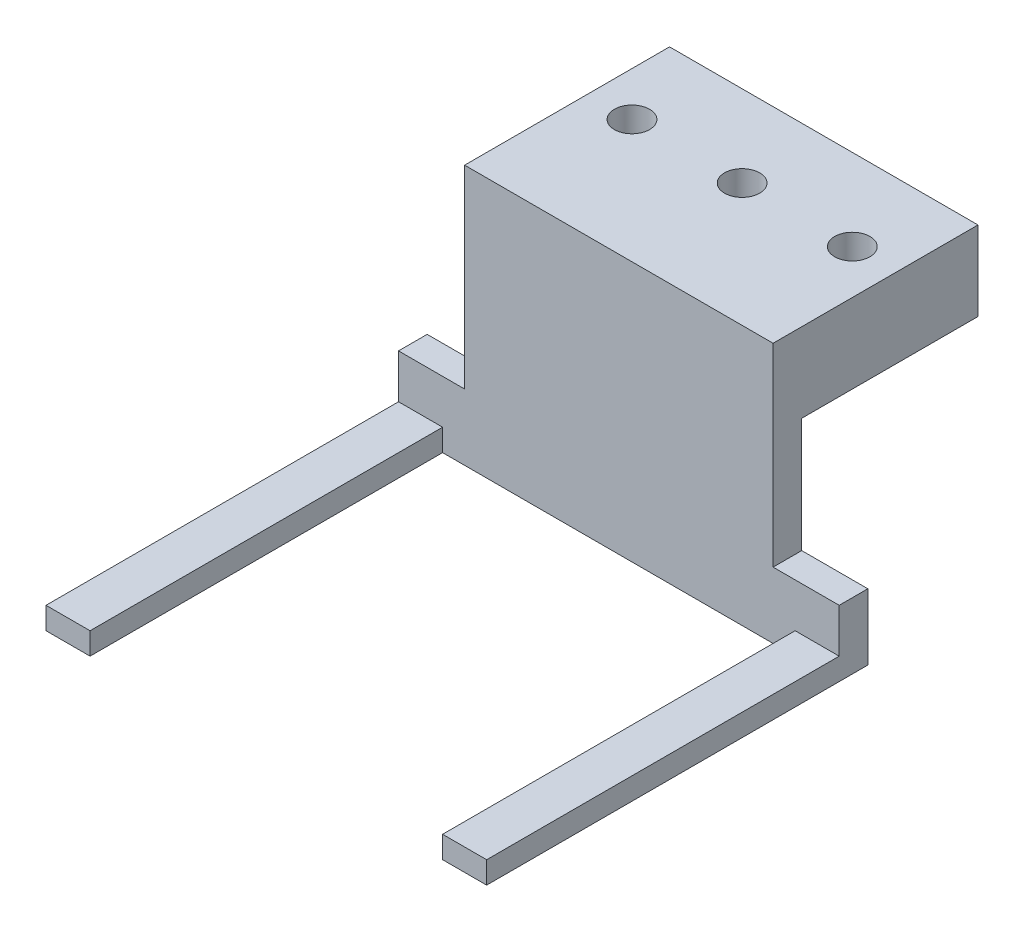
from build123d import *

# Parameters (mm, degrees)
SKETCH_1_W          = 70
SKETCH_1_H          = 40
EXTRUDE_1_DEPTH     = 18
SKETCH_3_W          = 70
SKETCH_3_H          = 6.5
EXTRUDE_2_DEPTH     = 59
SKETCH_4_W          = 15
SKETCH_4_H          = 15
EXTRUDE_3_DEPTH     = 6.5
SKETCH_5_W          = 10
SKETCH_5_H          = 5
EXTRUDE_4_DEPTH     = 80
SKETCH_7_R          = 4
CUT_EXTRUDE_1_DEPTH = 18


with BuildPart() as part:
    # 草图1 → 凸台-拉伸1 (new body)
    with BuildSketch(Plane(origin=(0, 0, 0), x_dir=(1, 0, 0), z_dir=(0, 1, 0))):
        with Locations((35, -20)):
            Rectangle(SKETCH_1_W, SKETCH_1_H)
    extrude(amount=EXTRUDE_1_DEPTH)

    # 草图3 → 凸台-拉伸2 (add)
    with BuildSketch(Plane(origin=(0, 18, 0), x_dir=(1, 0, 0), z_dir=(0, 1, 0))):
        with Locations((35, -43.25)):
            Rectangle(SKETCH_3_W, SKETCH_3_H)
    extrude(amount=-EXTRUDE_2_DEPTH)

    # 草图4 → 凸台-拉伸3 (add)
    with BuildSketch(Plane.XY.offset(46.5)):
        with Locations((-7.5, -33.5)):
            Rectangle(SKETCH_4_W, SKETCH_4_H)
    extrude_3 = extrude(amount=-EXTRUDE_3_DEPTH)

    # 镜向1: 凸台-拉伸3 across plane
    add(extrude_3.mirror(Plane(origin=(35, 0, 0), x_dir=(0, 0, 1), z_dir=(1, 0, 0))))

    # 草图5 → 凸台-拉伸4 (add)
    with BuildSketch(Plane.XY.offset(46.5)):
        with Locations((-10, -38.5)):
            Rectangle(SKETCH_5_W, SKETCH_5_H)
    extrude_4 = extrude(amount=EXTRUDE_4_DEPTH)

    # 镜向2: 凸台-拉伸4 across plane
    add(extrude_4.mirror(Plane(origin=(35, 0, 0), x_dir=(0, 0, 1), z_dir=(1, 0, 0))))

    # 草图7 → 切除-拉伸1 (cut)
    with BuildSketch(Plane(origin=(0, 18, 0), x_dir=(1, 0, 0), z_dir=(0, 1, 0))):
        with Locations(Location((35, -18.523, 0), (0, 0, 270))):
            Circle(SKETCH_7_R)
        with Locations(Location((60, -18.523, 0), (0, 0, 270))):
            Circle(SKETCH_7_R)
        with Locations(Location((10, -18.523, 0), (0, 0, 270))):
            Circle(SKETCH_7_R)
    extrude(amount=-CUT_EXTRUDE_1_DEPTH, mode=Mode.SUBTRACT)


solid = part.part
